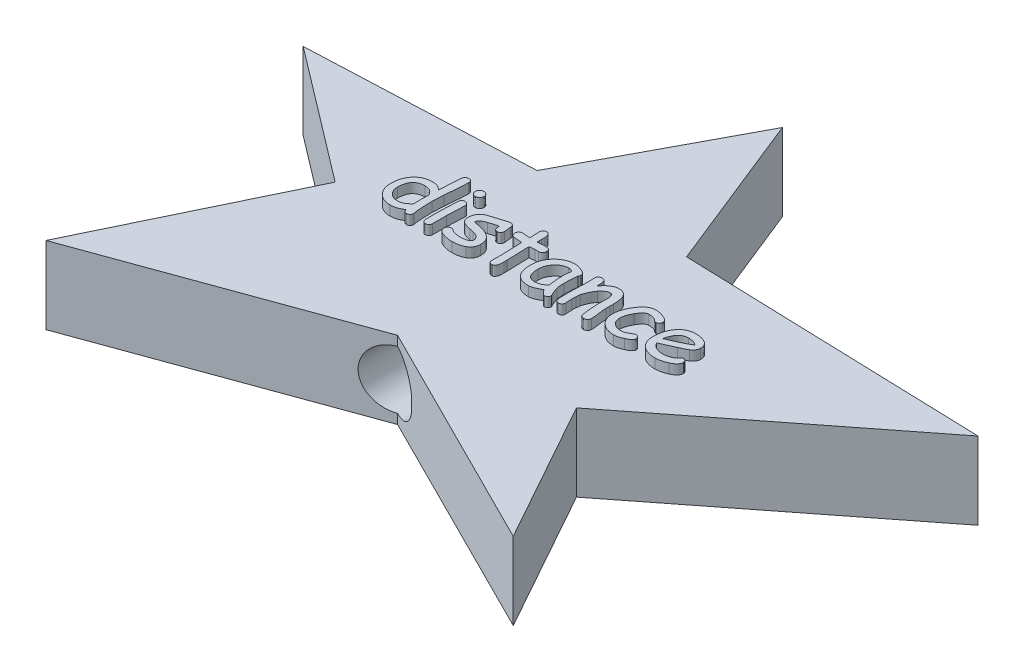
from build123d import *

# Parameters (mm, degrees)
BOSS_EXTRUDE1_DEPTH = 8
BOSS_EXTRUDE2_DEPTH = 1
SKETCH4_R           = 3
CUT_EXTRUDE2_DEPTH  = 6


with BuildPart() as part:
    # Sketch1 → Boss-Extrude1 (new body)
    with BuildSketch(Plane(origin=(0, 0, 0), x_dir=(1, 0, 0), z_dir=(0, 1, 0))):
        Polygon((0, 0), (6.633567825, -16.553321364), (37.779892833, -17.536232802), (14.474989977, -35.79394711), (22.717527292, -50.580418743), (-1.291526824, -38.544126608), (-27.987854373, -48.239108718), (-18.252203579, -28.044017747), (-32.070107167, -17.536232802), (-8.837607379, -16.553321364), align=None)
    extrude(amount=BOSS_EXTRUDE1_DEPTH)

    # Sketch2 → Boss-Extrude2 (add)
    # profile 1 of 9: a face of its own
    with BuildSketch(Plane(origin=(0, 8, 0), x_dir=(1, 0, 0), z_dir=(0, 1, 0))):
        with BuildLine():
            add(Edge.make_bspline(
                [(-10.461664561, -24.592927238), (-10.476703619, -24.785409538), (-10.506751891, -25.169992164), (-10.511070101, -25.555722418), (-10.513227061, -25.748395988)],
                knots=[0, 0, 0, 0, 1.000993213, 2, 2, 2, 2], degree=3))
            add(Edge.make_bspline(
                [(-10.513227061, -25.748395988), (-10.512713644, -25.853867404), (-10.511717154, -26.058576578), (-10.505880937, -26.355482299), (-10.496557455, -26.632464744), (-10.484200362, -26.889593577), (-10.466644874, -27.126751738), (-10.445516552, -27.343980566), (-10.422098659, -27.541199325), (-10.400455973, -27.665269594), (-10.390180186, -27.724177238)],
                knots=[0, 0, 0, 0, 1.277190667, 2.478895762, 3.595865585, 4.63308663, 5.595936305, 6.475156791, 7.276015736, 8, 8, 8, 8], degree=3))
            add(Edge.make_bspline(
                [(-10.390180186, -27.724177238), (-10.387821865, -27.740553642), (-10.383511259, -27.770486889), (-10.38326188, -27.800719285), (-10.383148936, -27.814411613)],
                knots=[0, 0, 0, 0, 1.094194912, 2, 2, 2, 2], degree=3))
            add(Edge.make_bspline(
                [(-10.383148936, -27.814411613), (-10.384347704, -27.839603647), (-10.386679004, -27.888595765), (-10.409406488, -27.958033211), (-10.44291052, -28.022083583), (-10.493353053, -28.074537965), (-10.549705295, -28.119532972), (-10.612972525, -28.150953858), (-10.680136838, -28.172950992), (-10.727106803, -28.174537895), (-10.751117686, -28.175349113)],
                knots=[0, 0, 0, 0, 1.05177295, 2.045431781, 3.033958183, 4.053154166, 5.067742846, 6.04098465, 6.998558172, 8, 8, 8, 8], degree=3))
            add(Edge.make_bspline(
                [(-10.751117686, -28.175349113), (-10.771151945, -28.174188661), (-10.810358913, -28.17191766), (-10.867223885, -28.154852627), (-10.919265193, -28.125791887), (-10.968198808, -28.086687154), (-11.011398366, -28.035288066), (-11.050169036, -27.973131262), (-11.085357075, -27.900499518), (-11.103652828, -27.847062759), (-11.113227061, -27.819099113)],
                knots=[0, 0, 0, 0, 0.880039557, 1.722234004, 2.582959466, 3.486806042, 4.461005431, 5.518665856, 6.701509044, 8, 8, 8, 8], degree=3))
            add(Edge.make_bspline(
                [(-11.113227061, -27.819099113), (-11.160856874, -27.852537597), (-11.254938286, -27.918587399), (-11.40188944, -28.00578518), (-11.552325261, -28.079303555), (-11.704551418, -28.142177348), (-11.860558081, -28.190885757), (-12.019963763, -28.224048968), (-12.182516657, -28.246486398), (-12.292058027, -28.249055557), (-12.347211436, -28.250349113)],
                knots=[0, 0, 0, 0, 1.049993693, 2.074013819, 3.079720164, 4.069387572, 5.043772359, 6.024055475, 7.005124043, 8, 8, 8, 8], degree=3))
            add(Edge.make_bspline(
                [(-12.347211436, -28.250349113), (-12.414102954, -28.248953288), (-12.54566823, -28.246207915), (-12.738565688, -28.21918088), (-12.923402596, -28.178016329), (-13.098376778, -28.117213766), (-13.26577896, -28.042527307), (-13.422604544, -27.947794462), (-13.571791488, -27.837472353), (-13.662104495, -27.752099433), (-13.707758311, -27.708942863)],
                knots=[0, 0, 0, 0, 1.066325706, 2.097297811, 3.10088944, 4.082125601, 5.046904096, 6.019277733, 6.998731951, 8, 8, 8, 8], degree=3))
            add(Edge.make_bspline(
                [(-13.707758311, -27.708942863), (-13.752256459, -27.662250343), (-13.840570359, -27.569581351), (-13.952332752, -27.414223683), (-14.05012974, -27.251200863), (-14.126731845, -27.076252453), (-14.188509069, -26.892869037), (-14.230946297, -26.699521585), (-14.259478971, -26.496903094), (-14.261959966, -26.3582642), (-14.263227061, -26.287458488)],
                knots=[0, 0, 0, 0, 0.986177228, 1.957231056, 2.922154339, 3.89105213, 4.874234197, 5.879440261, 6.916986874, 8, 8, 8, 8], degree=3))
            add(Edge.make_bspline(
                [(-14.263227061, -26.287458488), (-14.261960742, -26.20221789), (-14.259485224, -26.03558168), (-14.231147211, -25.792413139), (-14.188954231, -25.562076304), (-14.127549858, -25.344791963), (-14.049220639, -25.140742504), (-13.953794999, -24.948766585), (-13.839982641, -24.770621527), (-13.709508519, -24.606599999), (-13.566783739, -24.457879475), (-13.410492845, -24.32940096), (-13.244750475, -24.219377709), (-13.067998588, -24.130217317), (-12.881062534, -24.060026662), (-12.683488421, -24.012000276), (-12.476002383, -23.979741502), (-12.334056953, -23.976832638), (-12.261664561, -23.975349113)],
                knots=[0, 0, 0, 0, 1.189608909, 2.325557561, 3.413444142, 4.456306596, 5.473245952, 6.461102674, 7.444553072, 8.419008956, 9.383292003, 10.316965006, 11.238209328, 12.155343605, 13.075214562, 14.01970527, 14.990046571, 16, 16, 16, 16], degree=3))
            add(Edge.make_bspline(
                [(-12.261664561, -23.975349113), (-12.190084725, -23.977148028), (-12.054618513, -23.980552508), (-11.864293683, -24.005543689), (-11.698166181, -24.047691231), (-11.602468087, -24.094898326), (-11.557367686, -24.117145988)],
                knots=[0, 0, 0, 0, 1.183286269, 2.239391947, 3.170264262, 4, 4, 4, 4], degree=3))
            Line((-11.557367686, -24.117145988), (-11.188227061, -24.390192863))
            add(Edge.make_bspline(
                [(-11.188227061, -24.390192863), (-11.183222132, -24.257377604), (-11.173638513, -24.003058138), (-11.158747606, -23.638568509), (-11.142481062, -23.307688095), (-11.124835141, -23.010829769), (-11.107368116, -22.747919925), (-11.090071879, -22.518950233), (-11.0722907, -22.323864173), (-11.056895491, -22.205392092), (-11.049945811, -22.151911613)],
                knots=[0, 0, 0, 0, 1.421995194, 2.722887861, 3.902897711, 4.96628555, 5.904542012, 6.721910156, 7.423046717, 8, 8, 8, 8], degree=3))
            add(Edge.make_bspline(
                [(-11.049945811, -22.151911613), (-11.045000866, -22.12431965), (-11.035552848, -22.071601295), (-11.007618392, -21.999836619), (-10.974483233, -21.937097552), (-10.929677495, -21.886545739), (-10.876463429, -21.847491102), (-10.814516265, -21.819991513), (-10.744538021, -21.803598343), (-10.694960254, -21.801463337), (-10.669086436, -21.800349113)],
                knots=[0, 0, 0, 0, 1.166727176, 2.229197586, 3.199552252, 4.111778525, 5.021234505, 5.933023923, 6.921279318, 8, 8, 8, 8], degree=3))
            add(Edge.make_bspline(
                [(-10.669086436, -21.800349113), (-10.639322487, -21.801366631), (-10.58310893, -21.80328836), (-10.503936891, -21.820344065), (-10.437292252, -21.851478678), (-10.380646474, -21.892768527), (-10.339356625, -21.949414304), (-10.308222013, -22.016058943), (-10.291166308, -22.095230983), (-10.289244578, -22.15144454), (-10.288227061, -22.181208488)],
                knots=[0, 0, 0, 0, 1.156676403, 2.184552079, 3.122193726, 4, 4.877806274, 5.815447921, 6.843323597, 8, 8, 8, 8], degree=3))
            add(Edge.make_bspline(
                [(-10.288227061, -22.181208488), (-10.288662557, -22.205816872), (-10.289588838, -22.25815777), (-10.290095676, -22.341786931), (-10.294237126, -22.435518687), (-10.298882208, -22.539813465), (-10.304338448, -22.654709943), (-10.313447677, -22.779607445), (-10.320722802, -22.914874969), (-10.331994831, -23.060505339), (-10.343350425, -23.216390563), (-10.356488174, -23.382779129), (-10.370509303, -23.558953493), (-10.385396481, -23.746127388), (-10.403782147, -23.943256103), (-10.420404533, -24.150830115), (-10.441052795, -24.368310054), (-10.454674398, -24.516751784), (-10.461664561, -24.592927238)],
                knots=[0, 0, 0, 0, 0.488487756, 1.038990958, 1.659650684, 2.350346172, 3.111108541, 3.94243113, 4.835652975, 5.799528677, 6.841292333, 7.93775826, 9.112121531, 10.348929636, 11.66430314, 13.041467071, 14.481777404, 16, 16, 16, 16], degree=3))
        make_face()
        with BuildLine():
            add(Edge.make_bspline(
                [(-12.252289561, -24.725349113), (-12.306264115, -24.726254295), (-12.411046413, -24.728011549), (-12.562614013, -24.747838139), (-12.704535655, -24.776278627), (-12.836176012, -24.81800243), (-12.956807316, -24.874091888), (-13.067638465, -24.940331957), (-13.166948955, -25.020307815), (-13.257065305, -25.110855889), (-13.335550814, -25.214889955), (-13.403774233, -25.330531562), (-13.461434255, -25.458240868), (-13.508071123, -25.598485679), (-13.543978261, -25.750724705), (-13.569146548, -25.914927744), (-13.586447429, -26.090995957), (-13.587620803, -26.21280405), (-13.588227061, -26.275739738)],
                knots=[0, 0, 0, 0, 1.104243253, 2.143698025, 3.123882987, 4.064621318, 4.962690913, 5.841762256, 6.700969171, 7.566109394, 8.450547168, 9.361167402, 10.309521801, 11.313426945, 12.382121706, 13.507473269, 14.712163689, 16, 16, 16, 16], degree=3))
            add(Edge.make_bspline(
                [(-13.588227061, -26.275739738), (-13.586973346, -26.316795821), (-13.584491709, -26.398063313), (-13.568636501, -26.517749432), (-13.538342336, -26.632450026), (-13.49833966, -26.743039274), (-13.448472157, -26.850063195), (-13.385094929, -26.951622285), (-13.311268313, -27.049200775), (-13.226304431, -27.140416393), (-13.134380945, -27.224554338), (-13.037203975, -27.298447375), (-12.935846063, -27.361507705), (-12.830046507, -27.411266187), (-12.721403915, -27.452251793), (-12.608512736, -27.480052511), (-12.491467172, -27.496833276), (-12.412111392, -27.499165165), (-12.371820811, -27.500349113)],
                knots=[0, 0, 0, 0, 1.029546857, 2.0379122, 3.018986788, 3.998005947, 4.983762564, 5.9731616, 6.993724782, 8.047217791, 9.094088582, 10.114651764, 11.1040508, 12.080961111, 13.04158308, 14.010754683, 14.990018762, 16, 16, 16, 16], degree=3))
            add(Edge.make_bspline(
                [(-12.371820811, -27.500349113), (-12.318190439, -27.49935228), (-12.214666108, -27.497428062), (-12.06669107, -27.472851693), (-11.930460321, -27.436862704), (-11.848318202, -27.398436991), (-11.808148936, -27.379645988)],
                knots=[0, 0, 0, 0, 1.104933255, 2.132886155, 3.08694109, 4, 4, 4, 4], degree=3))
            add(Edge.make_bspline(
                [(-11.808148936, -27.379645988), (-11.781743279, -27.364387328), (-11.720323954, -27.328895818), (-11.621425475, -27.257778941), (-11.499354383, -27.167184247), (-11.413268185, -27.096113316), (-11.366352061, -27.057380363)],
                knots=[0, 0, 0, 0, 0.668068408, 1.553921218, 2.666911315, 4, 4, 4, 4], degree=3))
            add(Edge.make_bspline(
                [(-11.366352061, -27.057380363), (-11.346369908, -27.039456096), (-11.304719937, -27.002095496), (-11.268946874, -26.959063853), (-11.250336436, -26.936677238)],
                knots=[0, 0, 0, 0, 0.959527803, 2, 2, 2, 2], degree=3))
            Line((-11.250336436, -26.936677238), (-11.263227061, -26.264020988))
            Line((-11.263227061, -26.264020988), (-11.258539561, -25.814020988))
            Line((-11.258539561, -25.814020988), (-11.250336436, -25.354645988))
            add(Edge.make_bspline(
                [(-11.250336436, -25.354645988), (-11.276316059, -25.304600062), (-11.326772553, -25.207403041), (-11.423124386, -25.078963696), (-11.530331078, -24.968981619), (-11.651593684, -24.88057419), (-11.783983882, -24.810255872), (-11.929267011, -24.761428383), (-12.086451528, -24.729589089), (-12.195875254, -24.726791456), (-12.252289561, -24.725349113)],
                knots=[0, 0, 0, 0, 1.076360775, 2.090461057, 3.056777724, 4.002209313, 4.947522929, 5.911036705, 6.92301771, 8, 8, 8, 8], degree=3))
        make_face(mode=Mode.SUBTRACT)
    # profile 2 of 9: a face of its own
    with BuildSketch(Plane(origin=(0, 8, 0), x_dir=(1, 0, 0), z_dir=(0, 1, 0))):
        with BuildLine():
            add(Edge.make_bspline(
                [(-8.710883311, -23.075349113), (-8.740767948, -23.073894583), (-8.799268743, -23.071047261), (-8.883622052, -23.044706044), (-8.961962848, -23.003518761), (-9.031256924, -22.945893682), (-9.090707512, -22.877835974), (-9.130979547, -22.798972623), (-9.159439285, -22.71477864), (-9.161942642, -22.655674299), (-9.163227061, -22.625349113)],
                knots=[0, 0, 0, 0, 1.010360813, 1.97783596, 2.966809199, 3.992320244, 5.016120962, 6.005094201, 6.976456077, 8, 8, 8, 8], degree=3))
            add(Edge.make_bspline(
                [(-9.163227061, -22.625349113), (-9.161925275, -22.595033584), (-9.15938807, -22.535948064), (-9.131284133, -22.45194761), (-9.090301004, -22.373883118), (-9.031354229, -22.305856339), (-8.961615832, -22.24859436), (-8.883970841, -22.205735748), (-8.799224436, -22.179732076), (-8.740752967, -22.176831069), (-8.710883311, -22.175349113)],
                knots=[0, 0, 0, 0, 1.024235911, 1.996254496, 2.9742127, 3.99870558, 5.024909943, 6.020826883, 6.988956112, 8, 8, 8, 8], degree=3))
            add(Edge.make_bspline(
                [(-8.710883311, -22.175349113), (-8.681030958, -22.176862566), (-8.622593363, -22.179825231), (-8.538260971, -22.205178229), (-8.462340419, -22.249083134), (-8.393646895, -22.305747759), (-8.336576345, -22.374643766), (-8.293353765, -22.451331024), (-8.267534931, -22.536236676), (-8.264689725, -22.595092491), (-8.263227061, -22.625349113)],
                knots=[0, 0, 0, 0, 1.016055113, 1.988982862, 2.966544708, 3.987558975, 5.008573243, 5.997759729, 6.970687478, 8, 8, 8, 8], degree=3))
            add(Edge.make_bspline(
                [(-8.263227061, -22.625349113), (-8.264671935, -22.655615818), (-8.267482535, -22.714491247), (-8.293653055, -22.799585784), (-8.336173708, -22.877078048), (-8.393746522, -22.946000702), (-8.461984969, -23.003025911), (-8.538621032, -23.045262015), (-8.622546915, -23.070955413), (-8.681015254, -23.073863528), (-8.710883311, -23.075349113)],
                knots=[0, 0, 0, 0, 1.028642712, 2.000937341, 3.00113924, 4.021489097, 5.041838954, 6.012311441, 6.98460607, 8, 8, 8, 8], degree=3))
        make_face()
    # profile 3 of 9: a face of its own
    with BuildSketch(Plane(origin=(0, 8, 0), x_dir=(1, 0, 0), z_dir=(0, 1, 0))):
        with BuildLine():
            add(Edge.make_bspline(
                [(-8.488227061, -26.293317863), (-8.488227061, -26.337458488), (-8.488227061, -26.435895988), (-8.488227061, -26.598005363), (-8.488227061, -26.789802238), (-8.488227061, -27.000739738), (-8.488227061, -27.211677238), (-8.488227061, -27.402692863), (-8.488227061, -27.564411613), (-8.488227061, -27.662458488), (-8.488227061, -27.706599113)],
                knots=[0, 0, 0, 0, 0.749585406, 1.671641791, 2.752902156, 4.006633499, 5.253731343, 6.334991708, 7.250414594, 8, 8, 8, 8], degree=3))
            add(Edge.make_bspline(
                [(-8.488227061, -27.706599113), (-8.488951028, -27.734511606), (-8.490338723, -27.788014014), (-8.512278439, -27.863721729), (-8.542664834, -27.933142), (-8.589693679, -27.991208149), (-8.644509472, -28.040880472), (-8.710612136, -28.074388296), (-8.784029106, -28.096998909), (-8.836088473, -28.099201106), (-8.863227061, -28.100349113)],
                knots=[0, 0, 0, 0, 1.092439727, 2.093978393, 3.075920231, 4.049187075, 5.006468634, 5.960792571, 6.936959645, 8, 8, 8, 8], degree=3))
            add(Edge.make_bspline(
                [(-8.863227061, -28.100349113), (-8.889583276, -28.099176223), (-8.94048309, -28.096911106), (-9.0126947, -28.074191038), (-9.078481873, -28.04053033), (-9.134500196, -27.9916808), (-9.181130564, -27.932786521), (-9.213388604, -27.864068213), (-9.234566707, -27.787912765), (-9.236971708, -27.734486394), (-9.238227061, -27.706599113)],
                knots=[0, 0, 0, 0, 1.035816974, 2.000396925, 2.957821689, 3.929870099, 4.906299321, 5.898028532, 6.902821438, 8, 8, 8, 8], degree=3))
            add(Edge.make_bspline(
                [(-9.238227061, -27.706599113), (-9.238227061, -27.662458488), (-9.238227061, -27.564411613), (-9.238227061, -27.402692863), (-9.238227061, -27.211677238), (-9.238227061, -27.000739738), (-9.238227061, -26.789802238), (-9.238227061, -26.598005363), (-9.238227061, -26.435895988), (-9.238227061, -26.337458488), (-9.238227061, -26.293317863)],
                knots=[0, 0, 0, 0, 0.749585406, 1.665008292, 2.746268657, 3.993366501, 5.247097844, 6.328358209, 7.250414594, 8, 8, 8, 8], degree=3))
            add(Edge.make_bspline(
                [(-9.238227061, -26.293317863), (-9.2377231, -26.228078159), (-9.236654573, -26.089753259), (-9.229032424, -25.870587816), (-9.217429277, -25.62837033), (-9.200727093, -25.371052239), (-9.18402472, -25.113734146), (-9.172422077, -24.871516663), (-9.164784763, -24.651960812), (-9.163727352, -24.51324513), (-9.163227061, -24.447614738)],
                knots=[0, 0, 0, 0, 0.847472393, 1.796858752, 2.848468188, 3.99746302, 5.146457853, 6.198067289, 7.147453648, 8, 8, 8, 8], degree=3))
            add(Edge.make_bspline(
                [(-9.163227061, -24.447614738), (-9.161885936, -24.419370338), (-9.159297673, -24.364860908), (-9.139225039, -24.287467017), (-9.10535011, -24.218809424), (-9.060035547, -24.158930535), (-9.003059597, -24.110543392), (-8.938273567, -24.074718702), (-8.86520725, -24.054263182), (-8.814526517, -24.051686313), (-8.788227061, -24.050349113)],
                knots=[0, 0, 0, 0, 1.106105024, 2.134694061, 3.106937955, 4.089851019, 5.056291864, 6.015429525, 6.970158461, 8, 8, 8, 8], degree=3))
            add(Edge.make_bspline(
                [(-8.788227061, -24.050349113), (-8.761950991, -24.05175242), (-8.710939272, -24.054476764), (-8.63753306, -24.074153109), (-8.57325717, -24.110966073), (-8.516273338, -24.158826063), (-8.471457113, -24.219165689), (-8.435416575, -24.28693487), (-8.417652727, -24.365109703), (-8.414739326, -24.419422486), (-8.413227061, -24.447614738)],
                knots=[0, 0, 0, 0, 1.029274577, 1.998208454, 2.943413731, 3.909322518, 4.891694456, 5.870245778, 6.894503923, 8, 8, 8, 8], degree=3))
            add(Edge.make_bspline(
                [(-8.413227061, -24.447614738), (-8.413727352, -24.51324513), (-8.414784763, -24.651960812), (-8.422422077, -24.871516663), (-8.43402472, -25.113734146), (-8.450727093, -25.371052239), (-8.467429277, -25.62837033), (-8.479032424, -25.870587816), (-8.486654573, -26.089753259), (-8.4877231, -26.228078159), (-8.488227061, -26.293317863)],
                knots=[0, 0, 0, 0, 0.852546352, 1.801932711, 2.853542147, 4.00253698, 5.151531812, 6.203141248, 7.152527607, 8, 8, 8, 8], degree=3))
        make_face()
    # profile 4 of 9: a face of its own
    with BuildSketch(Plane(origin=(0, 8, 0), x_dir=(1, 0, 0), z_dir=(0, 1, 0))):
        with BuildLine():
            add(Edge.make_bspline(
                [(-4.428852061, -25.100349113), (-4.460773313, -25.098923186), (-4.5211081, -25.096228021), (-4.60370009, -25.06610973), (-4.671230646, -25.015997003), (-4.700837468, -24.970218427), (-4.715961436, -24.946833488)],
                knots=[0, 0, 0, 0, 1.113280398, 2.104226211, 3.031587307, 4, 4, 4, 4], degree=3))
            add(Edge.make_bspline(
                [(-4.715961436, -24.946833488), (-4.725485021, -24.924362241), (-4.748114914, -24.870966178), (-4.771520189, -24.772931991), (-4.795105557, -24.646667054), (-4.806780537, -24.552400099), (-4.813227061, -24.500349113)],
                knots=[0, 0, 0, 0, 0.637769588, 1.515464783, 2.628124727, 4, 4, 4, 4], degree=3))
            add(Edge.make_bspline(
                [(-4.813227061, -24.500349113), (-4.841004231, -24.506820123), (-4.899882635, -24.520536521), (-4.992912341, -24.546071358), (-5.096567716, -24.573669196), (-5.211065902, -24.605568329), (-5.33560327, -24.641770247), (-5.471005098, -24.682104022), (-5.617054022, -24.724709107), (-5.717573563, -24.756044178), (-5.769477061, -24.772224113)],
                knots=[0, 0, 0, 0, 0.688358012, 1.459091098, 2.328218768, 3.277569983, 4.327926315, 5.458620895, 6.687753033, 8, 8, 8, 8], degree=3))
            add(Edge.make_bspline(
                [(-5.769477061, -24.772224113), (-5.82369, -24.792970516), (-5.926054572, -24.83214376), (-6.067120628, -24.899152188), (-6.187106402, -24.96970116), (-6.285719853, -25.045001179), (-6.364065449, -25.123333186), (-6.41894238, -25.207240342), (-6.456209328, -25.294261761), (-6.460906928, -25.355077833), (-6.463227061, -25.385114738)],
                knots=[0, 0, 0, 0, 1.420783027, 2.682714635, 3.819374856, 4.821764251, 5.71454581, 6.515635649, 7.266876187, 8, 8, 8, 8], degree=3))
            add(Edge.make_bspline(
                [(-6.463227061, -25.385114738), (-6.422445329, -25.398518943), (-6.342533164, -25.424784602), (-6.259926772, -25.440634701), (-6.219477061, -25.448395988)],
                knots=[0, 0, 0, 0, 1.020663906, 2, 2, 2, 2], degree=3))
            add(Edge.make_bspline(
                [(-6.219477061, -25.448395988), (-6.142840838, -25.46205616), (-5.994248242, -25.488542334), (-5.779799621, -25.533567778), (-5.5812856, -25.584902842), (-5.397036445, -25.636579878), (-5.227855599, -25.693672942), (-5.07469451, -25.756355592), (-4.934944665, -25.819365571), (-4.850359281, -25.868786965), (-4.809711436, -25.892536613)],
                knots=[0, 0, 0, 0, 1.257132486, 2.437497217, 3.537587629, 4.567888916, 5.527452356, 6.418927424, 7.240209243, 8, 8, 8, 8], degree=3))
            add(Edge.make_bspline(
                [(-4.809711436, -25.892536613), (-4.756483012, -25.927652607), (-4.652386287, -25.996327569), (-4.514388119, -26.117633965), (-4.398348075, -26.251679232), (-4.30231939, -26.396175531), (-4.228956296, -26.553600651), (-4.176433429, -26.721828048), (-4.143851722, -26.901832944), (-4.140132762, -27.025599492), (-4.138227061, -27.089020988)],
                knots=[0, 0, 0, 0, 1.062419888, 2.077732601, 3.051996638, 4.01127431, 4.961174307, 5.937634961, 6.943185532, 8, 8, 8, 8], degree=3))
            add(Edge.make_bspline(
                [(-4.138227061, -27.089020988), (-4.140134954, -27.141074354), (-4.143846156, -27.242327655), (-4.169627661, -27.38959487), (-4.214656203, -27.526697304), (-4.276913435, -27.654419044), (-4.357937781, -27.771679004), (-4.455997993, -27.878942819), (-4.572053857, -27.9761041), (-4.659372185, -28.03030781), (-4.704242686, -28.058161613)],
                knots=[0, 0, 0, 0, 1.057807568, 2.057628868, 3.026718455, 3.981821159, 4.935338738, 5.913169247, 6.927634763, 8, 8, 8, 8], degree=3))
            add(Edge.make_bspline(
                [(-4.704242686, -28.058161613), (-4.744601879, -28.079401215), (-4.826320914, -28.122407025), (-4.955657265, -28.177812435), (-5.093121566, -28.222927553), (-5.237914531, -28.260672651), (-5.390619523, -28.289667451), (-5.550995941, -28.310928335), (-5.719317336, -28.32215261), (-5.833915565, -28.324267504), (-5.892523936, -28.325349113)],
                knots=[0, 0, 0, 0, 0.88872299, 1.799480584, 2.738474474, 3.706138857, 4.714061432, 5.766108683, 6.857532698, 8, 8, 8, 8], degree=3))
            add(Edge.make_bspline(
                [(-5.892523936, -28.325349113), (-5.978987362, -28.323606869), (-6.151033109, -28.320140135), (-6.405103214, -28.283572176), (-6.654997389, -28.231905269), (-6.815270071, -28.177068984), (-6.895648936, -28.149567863)],
                knots=[0, 0, 0, 0, 1.0130502, 2.0157769, 3.004885932, 4, 4, 4, 4], degree=3))
            add(Edge.make_bspline(
                [(-6.895648936, -28.149567863), (-6.944500568, -28.130986514), (-7.037310226, -28.095685161), (-7.163056145, -28.030784628), (-7.270814307, -27.961996309), (-7.358043417, -27.885363503), (-7.427837653, -27.80435142), (-7.477294908, -27.716481299), (-7.508186791, -27.622706221), (-7.511543449, -27.557609371), (-7.513227061, -27.524958488)],
                knots=[0, 0, 0, 0, 1.336630132, 2.539366265, 3.615209776, 4.599865311, 5.500995956, 6.338014507, 7.166391395, 8, 8, 8, 8], degree=3))
            add(Edge.make_bspline(
                [(-7.513227061, -27.524958488), (-7.511587469, -27.499005507), (-7.508338529, -27.447578243), (-7.484045669, -27.373241817), (-7.442704972, -27.304883417), (-7.38661261, -27.244214583), (-7.321609367, -27.192139201), (-7.249680699, -27.153966952), (-7.173506622, -27.128621379), (-7.120457793, -27.126446362), (-7.093695811, -27.125349113)],
                knots=[0, 0, 0, 0, 0.973650993, 1.929343195, 2.902994188, 3.951976707, 5.017346595, 6.014907148, 6.998563738, 8, 8, 8, 8], degree=3))
            add(Edge.make_bspline(
                [(-7.093695811, -27.125349113), (-7.070720833, -27.12809576), (-7.0199616, -27.134164), (-6.942409749, -27.172944559), (-6.855697245, -27.230438129), (-6.798888288, -27.281495614), (-6.767914561, -27.309333488)],
                knots=[0, 0, 0, 0, 0.723957644, 1.599458972, 2.691162313, 4, 4, 4, 4], degree=3))
            add(Edge.make_bspline(
                [(-6.767914561, -27.309333488), (-6.746934287, -27.324328404), (-6.698453677, -27.358978221), (-6.600522306, -27.393113825), (-6.475675482, -27.428761624), (-6.380664768, -27.445467176), (-6.328461436, -27.454645988)],
                knots=[0, 0, 0, 0, 0.659750349, 1.524532022, 2.639862039, 4, 4, 4, 4], degree=3))
            add(Edge.make_bspline(
                [(-6.328461436, -27.454645988), (-6.284758849, -27.461644489), (-6.201435018, -27.474987907), (-6.080973585, -27.48855204), (-5.971623974, -27.499329097), (-5.901921829, -27.500022476), (-5.869086436, -27.500349113)],
                knots=[0, 0, 0, 0, 1.149059048, 2.190808571, 3.14772333, 4, 4, 4, 4], degree=3))
            add(Edge.make_bspline(
                [(-5.869086436, -27.500349113), (-5.813565806, -27.499676877), (-5.705816358, -27.498372261), (-5.549830248, -27.481831244), (-5.403578227, -27.460372011), (-5.311474189, -27.435220511), (-5.266742686, -27.423005363)],
                knots=[0, 0, 0, 0, 1.092966145, 2.121130488, 3.087503021, 4, 4, 4, 4], degree=3))
            add(Edge.make_bspline(
                [(-5.266742686, -27.423005363), (-5.236848398, -27.413409956), (-5.180464617, -27.395312006), (-5.103043532, -27.360895858), (-5.037246127, -27.322992943), (-4.983180952, -27.279928864), (-4.93970664, -27.233280237), (-4.910185224, -27.180487434), (-4.89144895, -27.12425467), (-4.889307574, -27.085259821), (-4.888227061, -27.065583488)],
                knots=[0, 0, 0, 0, 1.343963468, 2.534856837, 3.622417877, 4.586634739, 5.487043191, 6.333773438, 7.159242063, 8, 8, 8, 8], degree=3))
            add(Edge.make_bspline(
                [(-4.888227061, -27.065583488), (-4.890118106, -27.023067634), (-4.893823155, -26.939768011), (-4.933899101, -26.821355131), (-4.995430054, -26.713260642), (-5.084445476, -26.618357317), (-5.195882872, -26.533255601), (-5.333052053, -26.462026378), (-5.492347012, -26.397401835), (-5.609245705, -26.367642634), (-5.671039561, -26.351911613)],
                knots=[0, 0, 0, 0, 0.8833748, 1.730761124, 2.577325104, 3.459384827, 4.423749971, 5.48782325, 6.672037441, 8, 8, 8, 8], degree=3))
            Line((-5.671039561, -26.351911613), (-6.099945811, -26.261677238))
            add(Edge.make_bspline(
                [(-6.099945811, -26.261677238), (-6.144112058, -26.252032151), (-6.229097773, -26.233472852), (-6.351728713, -26.204664044), (-6.463816084, -26.173001198), (-6.566238982, -26.140198068), (-6.658976994, -26.106350955), (-6.742031487, -26.071489247), (-6.815277194, -26.035750335), (-6.858738541, -26.008512057), (-6.879242686, -25.995661613)],
                knots=[0, 0, 0, 0, 1.310902894, 2.522469704, 3.652051718, 4.687281161, 5.640501579, 6.513563709, 7.298730768, 8, 8, 8, 8], degree=3))
            add(Edge.make_bspline(
                [(-6.879242686, -25.995661613), (-6.906026106, -25.977280816), (-6.958823885, -25.941047011), (-7.026329857, -25.874393401), (-7.08532588, -25.802347812), (-7.131761905, -25.72211777), (-7.168825812, -25.635625887), (-7.194050076, -25.541701399), (-7.21133134, -25.441220704), (-7.212585872, -25.371519922), (-7.213227061, -25.335895988)],
                knots=[0, 0, 0, 0, 1.005676932, 1.982476718, 2.930448784, 3.886285413, 4.847176578, 5.84073869, 6.896405766, 8, 8, 8, 8], degree=3))
            add(Edge.make_bspline(
                [(-7.213227061, -25.335895988), (-7.211081178, -25.27011804), (-7.206909763, -25.142251288), (-7.171585231, -24.957584302), (-7.11118342, -24.788422104), (-7.028498579, -24.633083638), (-6.919983903, -24.494117092), (-6.789636635, -24.368281929), (-6.634565504, -24.258328949), (-6.518409364, -24.200736724), (-6.458539561, -24.171052238)],
                knots=[0, 0, 0, 0, 1.068606491, 2.07728037, 3.04127803, 3.978772602, 4.924935478, 5.89489525, 6.914975919, 8, 8, 8, 8], degree=3))
            add(Edge.make_bspline(
                [(-6.458539561, -24.171052238), (-6.435947071, -24.161900799), (-6.387584747, -24.142310888), (-6.30955052, -24.114904314), (-6.22196603, -24.08546915), (-6.125762469, -24.053667225), (-6.019115453, -24.022515637), (-5.903886293, -23.987907687), (-5.778038988, -23.95475317), (-5.646443357, -23.919054881), (-5.51477052, -23.883615861), (-5.389601159, -23.84987922), (-5.274396821, -23.817790678), (-5.170475907, -23.783634367), (-5.074822971, -23.755463304), (-4.989763995, -23.726108098), (-4.914570556, -23.697792191), (-4.867892214, -23.67931281), (-4.846039561, -23.670661613)],
                knots=[0, 0, 0, 0, 0.692458193, 1.482301752, 2.349167551, 3.317828608, 4.360643236, 5.505531183, 6.735877285, 8.057724724, 9.379572162, 10.609918264, 11.741060781, 12.776526544, 13.717321461, 14.573680274, 15.332262693, 16, 16, 16, 16], degree=3))
            add(Edge.make_bspline(
                [(-4.846039561, -23.670661613), (-4.820078336, -23.659906728), (-4.767566942, -23.638152976), (-4.684489176, -23.616430544), (-4.598027039, -23.603211216), (-4.539447055, -23.601312776), (-4.509711436, -23.600349113)],
                knots=[0, 0, 0, 0, 0.973505182, 1.969094881, 2.969098002, 4, 4, 4, 4], degree=3))
            add(Edge.make_bspline(
                [(-4.509711436, -23.600349113), (-4.483814379, -23.601695925), (-4.433064342, -23.60433525), (-4.360286003, -23.625138375), (-4.296823579, -23.663734764), (-4.240153316, -23.71243177), (-4.194652573, -23.773811661), (-4.160998864, -23.844102456), (-4.142411764, -23.923634738), (-4.139662773, -23.979161654), (-4.138227061, -24.008161613)],
                knots=[0, 0, 0, 0, 1.005046543, 1.96957328, 2.900736222, 3.868001237, 4.853754822, 5.844163703, 6.87407461, 8, 8, 8, 8], degree=3))
            add(Edge.make_bspline(
                [(-4.138227061, -24.008161613), (-4.137681635, -24.02965935), (-4.136469563, -24.07743267), (-4.128699819, -24.155983573), (-4.116996123, -24.248596102), (-4.100705916, -24.350346588), (-4.084597673, -24.451728831), (-4.072578857, -24.544304958), (-4.065036863, -24.622880441), (-4.063785582, -24.671040099), (-4.063227061, -24.692536613)],
                knots=[0, 0, 0, 0, 0.748774702, 1.663963758, 2.747342733, 3.999972183, 5.252601633, 6.322484583, 7.251225298, 8, 8, 8, 8], degree=3))
            add(Edge.make_bspline(
                [(-4.063227061, -24.692536613), (-4.063970889, -24.721605809), (-4.065398227, -24.77738692), (-4.087019691, -24.856323217), (-4.117691549, -24.928231341), (-4.164174918, -24.988876326), (-4.21899396, -25.038354811), (-4.282112028, -25.075272139), (-4.353300594, -25.096453123), (-4.403324819, -25.099032741), (-4.428852061, -25.100349113)],
                knots=[0, 0, 0, 0, 1.132128027, 2.172449538, 3.176761216, 4.16893575, 5.131066294, 6.047428377, 7.003607416, 8, 8, 8, 8], degree=3))
        make_face()
    # profile 5 of 9: a face of its own
    with BuildSketch(Plane(origin=(0, 8, 0), x_dir=(1, 0, 0), z_dir=(0, 1, 0))):
        with BuildLine():
            add(Edge.make_bspline(
                [(-0.485492686, -24.754645988), (-0.51635993, -24.754064348), (-0.583605385, -24.752797221), (-0.686667024, -24.746488908), (-0.789721786, -24.74005521), (-0.856578139, -24.738813184), (-0.887445811, -24.738239738)],
                knots=[0, 0, 0, 0, 0.920717115, 2.005816965, 3.079282885, 4, 4, 4, 4], degree=3))
            add(Edge.make_bspline(
                [(-0.887445811, -24.738239738), (-0.897212455, -24.738603202), (-0.920274065, -24.739461436), (-0.960552255, -24.741755561), (-1.012109285, -24.746710115), (-1.075399496, -24.753724582), (-1.149919763, -24.763450828), (-1.235956461, -24.773603735), (-1.333109729, -24.78697957), (-1.401890425, -24.795727571), (-1.438227061, -24.800349113)],
                knots=[0, 0, 0, 0, 0.423045876, 0.998922293, 1.745956013, 2.664623774, 3.755177246, 4.998829415, 6.414490547, 8, 8, 8, 8], degree=3))
            Line((-1.438227061, -24.800349113), (-1.366742686, -27.101911613))
            Line((-1.366742686, -27.101911613), (-1.363227061, -27.274177238))
            Line((-1.363227061, -27.274177238), (-1.358539561, -27.472224113))
            add(Edge.make_bspline(
                [(-1.358539561, -27.472224113), (-1.358150091, -27.539059124), (-1.357424321, -27.663604823), (-1.373525503, -27.837873796), (-1.402395692, -27.985843071), (-1.445419732, -28.107912158), (-1.500469471, -28.205659366), (-1.57430329, -28.274540691), (-1.661903744, -28.31929138), (-1.726367025, -28.323299932), (-1.759320811, -28.325349113)],
                knots=[0, 0, 0, 0, 1.528621386, 2.848555227, 3.998559243, 4.968438543, 5.802376151, 6.536002899, 7.251601123, 8, 8, 8, 8], degree=3))
            add(Edge.make_bspline(
                [(-1.759320811, -28.325349113), (-1.78409796, -28.324500861), (-1.832947432, -28.322828487), (-1.902396574, -28.30127033), (-1.968073978, -28.270552338), (-2.026392852, -28.22650691), (-2.07625013, -28.173015358), (-2.11187741, -28.11083865), (-2.134086568, -28.04244994), (-2.136569427, -27.994658875), (-2.137836436, -27.970270988)],
                knots=[0, 0, 0, 0, 1.02652806, 2.023854815, 2.99735258, 4.030413798, 5.0421858, 6.01730832, 6.988227997, 8, 8, 8, 8], degree=3))
            add(Edge.make_bspline(
                [(-2.137836436, -27.970270988), (-2.13749265, -27.942535838), (-2.136722694, -27.880419259), (-2.134301597, -27.7784637), (-2.130594455, -27.657765889), (-2.126562179, -27.52492696), (-2.119967479, -27.391793899), (-2.116903073, -27.271057818), (-2.114307942, -27.16910814), (-2.11356216, -27.107381424), (-2.113227061, -27.079645988)],
                knots=[0, 0, 0, 0, 0.747128177, 1.673293467, 2.746990194, 3.999802079, 5.253011562, 6.337225674, 7.252871823, 8, 8, 8, 8], degree=3))
            Line((-2.113227061, -27.079645988), (-2.188227061, -24.800349113))
            add(Edge.make_bspline(
                [(-2.188227061, -24.800349113), (-2.213234627, -24.799309613), (-2.266412529, -24.797099144), (-2.350351767, -24.790763258), (-2.443709581, -24.78373945), (-2.546060592, -24.775603309), (-2.6577748, -24.766164268), (-2.778469645, -24.755525854), (-2.908620129, -24.744160449), (-2.998395759, -24.734854035), (-3.044867686, -24.730036613)],
                knots=[0, 0, 0, 0, 0.69876017, 1.485894292, 2.349961702, 3.312734694, 4.352486331, 5.480100212, 6.695585878, 8, 8, 8, 8], degree=3))
            add(Edge.make_bspline(
                [(-3.044867686, -24.730036613), (-3.072020219, -24.724968336), (-3.123386153, -24.715380399), (-3.194604592, -24.689220464), (-3.255635329, -24.653185315), (-3.304223709, -24.60493177), (-3.342752821, -24.548591567), (-3.370215812, -24.482515402), (-3.384594174, -24.406429474), (-3.386976438, -24.352748759), (-3.388227061, -24.324567863)],
                knots=[0, 0, 0, 0, 1.119713667, 2.118223711, 3.064630397, 3.972940108, 4.874581196, 5.819924503, 6.855520493, 8, 8, 8, 8], degree=3))
            add(Edge.make_bspline(
                [(-3.388227061, -24.324567863), (-3.386902253, -24.295536906), (-3.384343996, -24.239476957), (-3.363941261, -24.159565785), (-3.330778744, -24.08787357), (-3.284749224, -24.025051426), (-3.227677467, -23.974219482), (-3.162973577, -23.934944472), (-3.089720496, -23.912063721), (-3.038384291, -23.909742656), (-3.012055186, -23.908552238)],
                knots=[0, 0, 0, 0, 1.10983231, 2.143130888, 3.132909426, 4.116573268, 5.101031898, 6.039351675, 6.994430595, 8, 8, 8, 8], degree=3))
            Line((-3.012055186, -23.908552238), (-2.188227061, -23.975349113))
            add(Edge.make_bspline(
                [(-2.188227061, -23.975349113), (-2.188464963, -23.938627351), (-2.188978818, -23.859310254), (-2.193250243, -23.731597164), (-2.197082972, -23.586607863), (-2.205686817, -23.431592822), (-2.214415896, -23.279713349), (-2.218197824, -23.144486999), (-2.222526064, -23.032795893), (-2.22312093, -22.966367709), (-2.223383311, -22.937067863)],
                knots=[0, 0, 0, 0, 0.848238914, 1.8321519, 2.951624046, 4.198441437, 5.418224434, 6.465550233, 7.323191773, 8, 8, 8, 8], degree=3))
            add(Edge.make_bspline(
                [(-2.223383311, -22.937067863), (-2.22209652, -22.910358542), (-2.219574649, -22.858013216), (-2.198041572, -22.783818228), (-2.162965399, -22.716486891), (-2.113734404, -22.659104603), (-2.055219164, -22.610703894), (-1.989321536, -22.574942035), (-1.916385368, -22.554338306), (-1.866091537, -22.551705522), (-1.840180186, -22.550349113)],
                knots=[0, 0, 0, 0, 1.054098555, 2.065838051, 3.025944053, 4.034260515, 5.032715164, 6.013703489, 6.976661236, 8, 8, 8, 8], degree=3))
            add(Edge.make_bspline(
                [(-1.840180186, -22.550349113), (-1.81262394, -22.552126272), (-1.7592038, -22.555571445), (-1.683074776, -22.58338435), (-1.619125726, -22.632839956), (-1.562127966, -22.697851089), (-1.517474022, -22.782868141), (-1.481684915, -22.885246463), (-1.453498295, -23.005452109), (-1.443529646, -23.092387276), (-1.438227061, -23.138630363)],
                knots=[0, 0, 0, 0, 0.839179043, 1.626820346, 2.427236251, 3.279915469, 4.244758927, 5.33359862, 6.581671405, 8, 8, 8, 8], degree=3))
            add(Edge.make_bspline(
                [(-1.438227061, -23.138630363), (-1.434537846, -23.192907593), (-1.426476263, -23.311512905), (-1.426497041, -23.430399643), (-1.426508311, -23.494880363)],
                knots=[0, 0, 0, 0, 0.915257976, 2, 2, 2, 2], degree=3))
            Line((-1.426508311, -23.494880363), (-1.434711436, -23.726911613))
            Line((-1.434711436, -23.726911613), (-1.438227061, -23.975349113))
            add(Edge.make_bspline(
                [(-1.438227061, -23.975349113), (-1.399166847, -23.970256681), (-1.3257552, -23.960685719), (-1.222280981, -23.94741346), (-1.131913102, -23.93764528), (-1.054801431, -23.926872977), (-0.990060086, -23.922641889), (-0.939136438, -23.915338541), (-0.901125719, -23.913433767), (-0.880413942, -23.912455348), (-0.872211436, -23.912067863)],
                knots=[0, 0, 0, 0, 1.659498559, 3.118941497, 4.394719153, 5.488798678, 6.397639186, 7.126385805, 7.654021676, 8, 8, 8, 8], degree=3))
            add(Edge.make_bspline(
                [(-0.872211436, -23.912067863), (-0.839401233, -23.912530803), (-0.776514606, -23.913418111), (-0.686617013, -23.913547181), (-0.605419799, -23.918073177), (-0.533047316, -23.920585314), (-0.469715284, -23.926479627), (-0.415568689, -23.934135552), (-0.369759113, -23.939726926), (-0.342855946, -23.947332822), (-0.330805186, -23.950739738)],
                knots=[0, 0, 0, 0, 1.447613272, 2.774609975, 3.964759937, 5.034410691, 5.968933724, 6.76833278, 7.448298163, 8, 8, 8, 8], degree=3))
            add(Edge.make_bspline(
                [(-0.330805186, -23.950739738), (-0.311295633, -23.957788278), (-0.273380399, -23.971486543), (-0.224090955, -24.004148031), (-0.181324626, -24.042282397), (-0.147842699, -24.088695932), (-0.11997228, -24.140858818), (-0.101743071, -24.200940421), (-0.089738107, -24.267442138), (-0.088742371, -24.31435314), (-0.088227061, -24.338630363)],
                knots=[0, 0, 0, 0, 1.005767345, 1.954627295, 2.855857429, 3.779451047, 4.722967414, 5.720622874, 6.820384471, 8, 8, 8, 8], degree=3))
            add(Edge.make_bspline(
                [(-0.088227061, -24.338630363), (-0.089412746, -24.367703772), (-0.091706388, -24.423944657), (-0.114193511, -24.50387604), (-0.14739986, -24.577198404), (-0.197978814, -24.638875502), (-0.256800689, -24.690904359), (-0.326097456, -24.728229512), (-0.403183765, -24.751185301), (-0.457595285, -24.753473039), (-0.485492686, -24.754645988)],
                knots=[0, 0, 0, 0, 1.079895878, 2.088998209, 3.071435682, 4.05505688, 5.03479875, 5.978573441, 6.963591752, 8, 8, 8, 8], degree=3))
        make_face()
    # profile 6 of 9: a face of its own
    with BuildSketch(Plane(origin=(0, 8, 0), x_dir=(1, 0, 0), z_dir=(0, 1, 0))):
        with BuildLine():
            add(Edge.make_bspline(
                [(3.741460439, -28.400349113), (3.725904656, -28.396830489), (3.68743744, -28.388129437), (3.627352502, -28.345740825), (3.551054383, -28.284737301), (3.497256974, -28.23257636), (3.467241689, -28.203474113)],
                knots=[0, 0, 0, 0, 0.555695463, 1.374155035, 2.534957635, 4, 4, 4, 4], degree=3))
            add(Edge.make_bspline(
                [(3.467241689, -28.203474113), (3.439162108, -28.174093213), (3.385224646, -28.117656076), (3.313832857, -28.032425432), (3.250846308, -27.954014166), (3.217191833, -27.900660316), (3.201226064, -27.875349113)],
                knots=[0, 0, 0, 0, 1.151952229, 2.212760143, 3.152128841, 4, 4, 4, 4], degree=3))
            add(Edge.make_bspline(
                [(3.201226064, -27.875349113), (3.139691244, -27.91044309), (3.021387854, -27.977912799), (2.847931006, -28.069912726), (2.685277511, -28.14734332), (2.534407612, -28.210938683), (2.395152726, -28.260803824), (2.268253895, -28.297759843), (2.15242997, -28.320524965), (2.079044495, -28.323807676), (2.044585439, -28.325349113)],
                knots=[0, 0, 0, 0, 1.357382431, 2.60962722, 3.761399541, 4.808177135, 5.745711274, 6.593953003, 7.339773276, 8, 8, 8, 8], degree=3))
            add(Edge.make_bspline(
                [(2.044585439, -28.325349113), (1.969509917, -28.323902515), (1.824396957, -28.321106396), (1.61460515, -28.29605086), (1.420468614, -28.255950414), (1.242355427, -28.197984222), (1.07856146, -28.125908802), (0.931956892, -28.034737672), (0.798704817, -27.929468403), (0.725389537, -27.844955859), (0.688726064, -27.802692863)],
                knots=[0, 0, 0, 0, 1.198237041, 2.31606415, 3.368011987, 4.358092637, 5.301625415, 6.21724908, 7.108482723, 8, 8, 8, 8], degree=3))
            add(Edge.make_bspline(
                [(0.688726064, -27.802692863), (0.656465255, -27.759619591), (0.590624423, -27.671711686), (0.508636087, -27.523229712), (0.439683798, -27.358475887), (0.384275264, -27.177262206), (0.339326805, -26.98035163), (0.308664554, -26.767162388), (0.28952369, -26.537421562), (0.287711305, -26.37890546), (0.286772939, -26.296833488)],
                knots=[0, 0, 0, 0, 0.812552431, 1.658331892, 2.555229492, 3.507519434, 4.518618694, 5.604829532, 6.759896565, 8, 8, 8, 8], degree=3))
            add(Edge.make_bspline(
                [(0.286772939, -26.296833488), (0.288828605, -26.218219217), (0.292873957, -26.063513961), (0.324021683, -25.835827518), (0.375473846, -25.616728092), (0.448433997, -25.406371304), (0.54179698, -25.204812056), (0.654448851, -25.011582983), (0.789378938, -24.827983424), (0.942639617, -24.655268435), (1.110242257, -24.497019553), (1.286907701, -24.356848831), (1.472522323, -24.23841119), (1.666105842, -24.141880999), (1.868399388, -24.067984196), (2.077392912, -24.013587382), (2.295135062, -23.981206791), (2.442914143, -23.977323035), (2.518022939, -23.975349113)],
                knots=[0, 0, 0, 0, 1.054731984, 2.075610185, 3.077564362, 4.070606348, 5.058056501, 6.05423441, 7.067099876, 8.110607853, 9.148928189, 10.156761868, 11.132552149, 12.098435385, 13.053748134, 14.01750944, 14.992398115, 16, 16, 16, 16], degree=3))
            add(Edge.make_bspline(
                [(2.518022939, -23.975349113), (2.577132685, -23.977976912), (2.700072918, -23.983442375), (2.889100259, -24.017810392), (3.088240168, -24.074591867), (3.221181975, -24.127265087), (3.290288564, -24.154645988)],
                knots=[0, 0, 0, 0, 0.889365109, 1.849758484, 2.882248842, 4, 4, 4, 4], degree=3))
            add(Edge.make_bspline(
                [(3.290288564, -24.154645988), (3.332784014, -24.173134013), (3.413285172, -24.208156759), (3.523347493, -24.268115229), (3.616346562, -24.33093173), (3.6929662, -24.396879719), (3.752570151, -24.466377501), (3.795645423, -24.538744878), (3.823815905, -24.614348247), (3.826727391, -24.666520944), (3.828179189, -24.692536613)],
                knots=[0, 0, 0, 0, 1.381705711, 2.617431031, 3.732296057, 4.723070722, 5.624086893, 6.449303074, 7.226752293, 8, 8, 8, 8], degree=3))
            add(Edge.make_bspline(
                [(3.828179189, -24.692536613), (3.827445081, -24.710255171), (3.825996553, -24.745217124), (3.809234296, -24.795426037), (3.785049299, -24.843503891), (3.760890708, -24.870743706), (3.748491689, -24.884724113)],
                knots=[0, 0, 0, 0, 0.993157303, 1.959680908, 2.952838212, 4, 4, 4, 4], degree=3))
            add(Edge.make_bspline(
                [(3.748491689, -24.884724113), (3.741738085, -24.913932437), (3.726452945, -24.980038366), (3.713831641, -25.092878151), (3.6970279, -25.229311394), (3.686675027, -25.390503773), (3.677574982, -25.576077991), (3.668770728, -25.785828482), (3.665056686, -26.020263637), (3.662903288, -26.184724483), (3.661772939, -26.271052238)],
                knots=[0, 0, 0, 0, 0.516827984, 1.169714305, 1.956377237, 2.888851328, 3.955038626, 5.162311074, 6.510458132, 8, 8, 8, 8], degree=3))
            add(Edge.make_bspline(
                [(3.661772939, -26.271052238), (3.662161703, -26.349202717), (3.662897087, -26.497031968), (3.67581172, -26.705487943), (3.69627294, -26.888668548), (3.720688948, -27.000495958), (3.732085439, -27.052692863)],
                knots=[0, 0, 0, 0, 1.19200198, 2.25478799, 3.185399486, 4, 4, 4, 4], degree=3))
            add(Edge.make_bspline(
                [(3.732085439, -27.052692863), (3.736247317, -27.06913635), (3.745624496, -27.10618538), (3.764597738, -27.166727023), (3.789588355, -27.23795645), (3.818594692, -27.320245393), (3.854268573, -27.413033424), (3.894940603, -27.517082681), (3.942395753, -27.631927662), (3.975098641, -27.712440619), (3.992241689, -27.754645988)],
                knots=[0, 0, 0, 0, 0.543324072, 1.224170439, 2.031506418, 2.961691587, 4.019197454, 5.215989979, 6.540605439, 8, 8, 8, 8], degree=3))
            add(Edge.make_bspline(
                [(3.992241689, -27.754645988), (3.997656733, -27.767949497), (4.00966611, -27.797453752), (4.030965612, -27.845996023), (4.05812113, -27.902574367), (4.077067863, -27.943680322), (4.087163564, -27.965583488)],
                knots=[0, 0, 0, 0, 0.745010443, 1.652269271, 2.749019729, 4, 4, 4, 4], degree=3))
            Line((4.087163564, -27.965583488), (4.111772939, -28.033552238))
            add(Edge.make_bspline(
                [(4.111772939, -28.033552238), (4.110571976, -28.059129907), (4.108236128, -28.108877903), (4.085541988, -28.179495748), (4.0520144, -28.244597793), (4.002001992, -28.298444239), (3.944613088, -28.343287997), (3.881278358, -28.3766386), (3.812477591, -28.39592695), (3.76540515, -28.398858101), (3.741460439, -28.400349113)],
                knots=[0, 0, 0, 0, 1.055781092, 2.053470688, 3.044847395, 4.064324308, 5.067244292, 6.051071831, 7.008623294, 8, 8, 8, 8], degree=3))
        make_face()
        with BuildLine():
            add(Edge.make_bspline(
                [(2.911772939, -25.607770988), (2.913215689, -25.547594671), (2.916226886, -25.421999268), (2.931344561, -25.226279462), (2.960481711, -25.016963701), (2.985551393, -24.873321487), (2.998491689, -24.799177238)],
                knots=[0, 0, 0, 0, 0.88697149, 1.851218968, 2.890857011, 4, 4, 4, 4], degree=3))
            add(Edge.make_bspline(
                [(2.998491689, -24.799177238), (2.953175112, -24.77602578), (2.870484403, -24.733780522), (2.75289368, -24.68840727), (2.65620159, -24.658109193), (2.597463096, -24.652700359), (2.571929189, -24.650349113)],
                knots=[0, 0, 0, 0, 1.341238509, 2.447403828, 3.325078951, 4, 4, 4, 4], degree=3))
            add(Edge.make_bspline(
                [(2.571929189, -24.650349113), (2.520675634, -24.652008385), (2.41919281, -24.655293767), (2.269658376, -24.678990999), (2.126033544, -24.719338584), (1.987064949, -24.774365478), (1.855055527, -24.848427409), (1.726154177, -24.934937567), (1.603958933, -25.039075022), (1.489367087, -25.157830815), (1.384402361, -25.286299269), (1.290185573, -25.420137815), (1.213429257, -25.560746063), (1.147774318, -25.704758506), (1.099218788, -25.854833653), (1.061953815, -26.008987646), (1.040887454, -26.168513183), (1.03815086, -26.276463219), (1.036772939, -26.330817863)],
                knots=[0, 0, 0, 0, 0.976615751, 1.933714126, 2.876548638, 3.815200477, 4.774727746, 5.755505532, 6.769702424, 7.827890142, 8.896423243, 9.928951538, 10.941972897, 11.945015674, 12.940821975, 13.942980332, 14.964256267, 16, 16, 16, 16], degree=3))
            add(Edge.make_bspline(
                [(1.036772939, -26.330817863), (1.037253996, -26.383974028), (1.03818908, -26.487299764), (1.050930857, -26.636980298), (1.06720712, -26.776950755), (1.093442844, -26.906032241), (1.125346363, -27.025224462), (1.167307039, -27.133223305), (1.213176548, -27.232703565), (1.268799226, -27.320860889), (1.330993037, -27.39945877), (1.401784308, -27.46616415), (1.479134011, -27.52346414), (1.563517077, -27.57073485), (1.656573331, -27.605778868), (1.756054016, -27.63094708), (1.86271902, -27.648592997), (1.936306136, -27.649751428), (1.974272939, -27.650349113)],
                knots=[0, 0, 0, 0, 1.385053073, 2.692286587, 3.913500936, 5.055672189, 6.122813422, 7.125029461, 8.072314099, 8.973498475, 9.835345066, 10.677972226, 11.50067925, 12.339298428, 13.190189537, 14.084155314, 15.011532147, 16, 16, 16, 16], degree=3))
            add(Edge.make_bspline(
                [(1.974272939, -27.650349113), (2.036473829, -27.648461236), (2.156748191, -27.644810753), (2.32995068, -27.619353225), (2.488980544, -27.575526569), (2.585694768, -27.531296922), (2.632866689, -27.509724113)],
                knots=[0, 0, 0, 0, 1.098427608, 2.12396769, 3.084973818, 4, 4, 4, 4], degree=3))
            add(Edge.make_bspline(
                [(2.632866689, -27.509724113), (2.659662488, -27.494075193), (2.719882306, -27.458906429), (2.813873446, -27.391378882), (2.922239927, -27.30495265), (2.997589256, -27.239343686), (3.038335439, -27.203864738)],
                knots=[0, 0, 0, 0, 0.731520458, 1.643990121, 2.725955338, 4, 4, 4, 4], degree=3))
            add(Edge.make_bspline(
                [(3.038335439, -27.203864738), (3.028437491, -27.11794179), (3.009278365, -26.951623621), (2.983651284, -26.710196554), (2.960868456, -26.485659643), (2.943673324, -26.277766942), (2.928931502, -26.08680395), (2.919909235, -25.912125597), (2.913576196, -25.754299971), (2.912349868, -25.654651037), (2.911772939, -25.607770988)],
                knots=[0, 0, 0, 0, 1.29584854, 2.508330538, 3.637509546, 4.677124825, 5.633672839, 6.506959432, 7.297595963, 8, 8, 8, 8], degree=3))
        make_face(mode=Mode.SUBTRACT)
    # profile 7 of 9: a face of its own
    with BuildSketch(Plane(origin=(0, 8, 0), x_dir=(1, 0, 0), z_dir=(0, 1, 0))):
        with BuildLine():
            add(Edge.make_bspline(
                [(7.818413564, -28.400349113), (7.789776654, -28.399410128), (7.735413339, -28.39762759), (7.659091771, -28.379289867), (7.591361723, -28.351650585), (7.534481522, -28.309723289), (7.487473597, -28.256543361), (7.451126885, -28.19227931), (7.424970535, -28.116380383), (7.416345832, -28.061485895), (7.411772939, -28.032380363)],
                knots=[0, 0, 0, 0, 1.120660435, 2.127422838, 3.060545721, 3.970376627, 4.870878344, 5.824514606, 6.846538862, 8, 8, 8, 8], degree=3))
            Line((7.411772939, -28.032380363), (7.312163564, -27.174567863))
            add(Edge.make_bspline(
                [(7.312163564, -27.174567863), (7.304260624, -27.09921949), (7.288759528, -26.951428631), (7.274098288, -26.732915081), (7.264116706, -26.521925622), (7.262545096, -26.38356317), (7.261772939, -26.315583488)],
                knots=[0, 0, 0, 0, 1.056006236, 2.071286475, 3.052392247, 4, 4, 4, 4], degree=3))
            add(Edge.make_bspline(
                [(7.261772939, -26.315583488), (7.262116927, -26.294098022), (7.262905074, -26.244870354), (7.265479364, -26.161671074), (7.268669777, -26.059295617), (7.274811273, -25.944105018), (7.280133608, -25.828475446), (7.285334998, -25.725774116), (7.287538789, -25.642153794), (7.288365323, -25.592927661), (7.288726064, -25.571442863)],
                knots=[0, 0, 0, 0, 0.692529151, 1.586728157, 2.682653318, 3.993458863, 5.304264407, 6.413271843, 7.307470849, 8, 8, 8, 8], degree=3))
            add(Edge.make_bspline(
                [(7.288726064, -25.571442863), (7.288002549, -25.505406826), (7.286647424, -25.381723129), (7.272411794, -25.209144322), (7.246323761, -25.063154206), (7.215358517, -24.941857168), (7.168819412, -24.847630692), (7.114165226, -24.777065194), (7.044580735, -24.732341695), (6.993206316, -24.727673116), (6.967632314, -24.725349113)],
                knots=[0, 0, 0, 0, 1.609712623, 3.014947852, 4.214147863, 5.223911581, 6.054315981, 6.757804149, 7.381639367, 8, 8, 8, 8], degree=3))
            add(Edge.make_bspline(
                [(6.967632314, -24.725349113), (6.929996771, -24.72693185), (6.854319631, -24.7301144), (6.741919702, -24.756154825), (6.631083704, -24.797227719), (6.522231084, -24.856196998), (6.414645978, -24.930074399), (6.308275487, -25.020723036), (6.20275172, -25.127010823), (6.137629096, -25.207542196), (6.103960439, -25.249177238)],
                knots=[0, 0, 0, 0, 0.862908479, 1.73512694, 2.634339985, 3.568791753, 4.56840037, 5.624425298, 6.771818386, 8, 8, 8, 8], degree=3))
            add(Edge.make_bspline(
                [(6.103960439, -25.249177238), (6.073476745, -25.289900019), (6.011889936, -25.372173054), (5.925769243, -25.502765703), (5.846891166, -25.642399448), (5.771783116, -25.788992753), (5.701021108, -25.943282726), (5.635817023, -26.105597294), (5.575782429, -26.276138858), (5.540603275, -26.393168962), (5.522710439, -26.452692863)],
                knots=[0, 0, 0, 0, 0.907921412, 1.834291501, 2.7899831, 3.769194894, 4.773894665, 5.818826687, 6.890610685, 8, 8, 8, 8], degree=3))
            add(Edge.make_bspline(
                [(5.522710439, -26.452692863), (5.520751556, -26.480035552), (5.516609031, -26.537858158), (5.51017516, -26.629393373), (5.498973189, -26.730484417), (5.490717767, -26.80113603), (5.486382314, -26.838239738)],
                knots=[0, 0, 0, 0, 0.849325914, 1.796101322, 2.842590997, 4, 4, 4, 4], degree=3))
            add(Edge.make_bspline(
                [(5.486382314, -26.838239738), (5.479057101, -26.90262411), (5.464614197, -27.029568866), (5.462710909, -27.157315451), (5.461772939, -27.220270988)],
                knots=[0, 0, 0, 0, 1.014368362, 2, 2, 2, 2], degree=3))
            add(Edge.make_bspline(
                [(5.461772939, -27.220270988), (5.461966185, -27.242153235), (5.462397898, -27.291038497), (5.468010441, -27.371866366), (5.474506738, -27.46803645), (5.485276496, -27.573782628), (5.495450963, -27.67960318), (5.503924672, -27.775258233), (5.509158122, -27.85653902), (5.509613832, -27.90581195), (5.509819814, -27.928083488)],
                knots=[0, 0, 0, 0, 0.739853185, 1.65284295, 2.738922499, 3.999449379, 5.246826206, 6.333949561, 7.246939326, 8, 8, 8, 8], degree=3))
            add(Edge.make_bspline(
                [(5.509819814, -27.928083488), (5.508485656, -27.956333646), (5.505910838, -28.010854188), (5.485744477, -28.088170619), (5.452097448, -28.157320223), (5.405330152, -28.216323728), (5.349083454, -28.265129531), (5.28374873, -28.299753556), (5.211588393, -28.321580758), (5.160757917, -28.324075884), (5.134819814, -28.325349113)],
                knots=[0, 0, 0, 0, 1.107165718, 2.136741115, 3.109917337, 4.103156235, 5.070523843, 6.009810118, 6.984433085, 8, 8, 8, 8], degree=3))
            add(Edge.make_bspline(
                [(5.134819814, -28.325349113), (5.108080546, -28.32416426), (5.056428864, -28.321875505), (4.983334021, -28.299417672), (4.917432435, -28.265772547), (4.861804139, -28.216566307), (4.817531086, -28.156326367), (4.783714279, -28.087522653), (4.765280339, -28.009484029), (4.762457135, -27.95512689), (4.760991689, -27.926911613)],
                knots=[0, 0, 0, 0, 1.042984329, 2.014710921, 2.964693737, 3.917620722, 4.889347314, 5.873367933, 6.896124546, 8, 8, 8, 8], degree=3))
            add(Edge.make_bspline(
                [(4.760991689, -27.926911613), (4.760785686, -27.904640084), (4.760329932, -27.855367173), (4.755096904, -27.774086211), (4.746586802, -27.678044683), (4.73637989, -27.571833623), (4.726186857, -27.465621792), (4.717608022, -27.369193729), (4.712460971, -27.287516743), (4.71198596, -27.237854644), (4.711772939, -27.215583488)],
                knots=[0, 0, 0, 0, 0.749259206, 1.657640177, 2.739275709, 3.993439419, 5.24760313, 6.329238662, 7.250740794, 8, 8, 8, 8], degree=3))
            add(Edge.make_bspline(
                [(4.711772939, -27.215583488), (4.712217516, -27.180037619), (4.71314575, -27.105821331), (4.713493824, -26.989774887), (4.718152129, -26.864034398), (4.720546144, -26.728038409), (4.727551295, -26.582400819), (4.732326324, -26.426854329), (4.741706783, -26.261706908), (4.748662693, -26.089362625), (4.759211544, -25.917209796), (4.765074813, -25.751495156), (4.773286404, -25.596104229), (4.776848952, -25.450331663), (4.782739159, -25.314449157), (4.783960276, -25.188231236), (4.787386627, -25.071848256), (4.786971664, -24.997616965), (4.786772939, -24.962067863)],
                knots=[0, 0, 0, 0, 0.756695821, 1.579906643, 2.469943787, 3.434787344, 4.474973078, 5.573318625, 6.747154482, 7.995737333, 9.244735405, 10.418188362, 11.525186383, 12.556762431, 13.52185675, 14.420013075, 15.243349864, 16, 16, 16, 16], degree=3))
            add(Edge.make_bspline(
                [(4.786772939, -24.962067863), (4.786421122, -24.938239243), (4.785648176, -24.885887537), (4.783445895, -24.799531256), (4.778305859, -24.698388373), (4.772806792, -24.586673733), (4.76665929, -24.475390598), (4.763444609, -24.373795061), (4.760912984, -24.287859385), (4.760157879, -24.235506518), (4.759819814, -24.212067863)],
                knots=[0, 0, 0, 0, 0.762047274, 1.674225122, 2.762081399, 4.000256622, 5.250907004, 6.325777794, 7.25044192, 8, 8, 8, 8], degree=3))
            add(Edge.make_bspline(
                [(4.759819814, -24.212067863), (4.761002149, -24.184953848), (4.763307793, -24.132079412), (4.786291737, -24.056667348), (4.824671894, -23.98966087), (4.877168348, -23.932096836), (4.939653306, -23.884228397), (5.011417833, -23.849648782), (5.090358613, -23.829361721), (5.145246998, -23.826712408), (5.173491689, -23.825349113)],
                knots=[0, 0, 0, 0, 1.025580388, 1.999961365, 2.95502325, 3.930191515, 4.934164669, 5.920955794, 6.930156876, 8, 8, 8, 8], degree=3))
            add(Edge.make_bspline(
                [(5.173491689, -23.825349113), (5.204088588, -23.826923122), (5.262753252, -23.829941032), (5.346160914, -23.852981543), (5.416549795, -23.895862559), (5.477632756, -23.952500282), (5.525380566, -24.026863579), (5.561429763, -24.116810141), (5.587056118, -24.222208522), (5.594780382, -24.29824929), (5.598882314, -24.338630363)],
                knots=[0, 0, 0, 0, 0.981438758, 1.881752029, 2.741463425, 3.601448804, 4.532970262, 5.550009211, 6.698944533, 8, 8, 8, 8], degree=3))
            Line((5.598882314, -24.338630363), (5.611772939, -24.800349113))
            add(Edge.make_bspline(
                [(5.611772939, -24.800349113), (5.66741202, -24.729206051), (5.774319408, -24.592508627), (5.944812482, -24.408292478), (6.117130403, -24.252513396), (6.290929392, -24.12496828), (6.465713311, -24.024188701), (6.642458012, -23.953627399), (6.820852277, -23.908477225), (6.940813541, -23.903047943), (7.000444814, -23.900349113)],
                knots=[0, 0, 0, 0, 1.263598251, 2.427933541, 3.508005564, 4.509617483, 5.439945349, 6.323141168, 7.166454043, 8, 8, 8, 8], degree=3))
            add(Edge.make_bspline(
                [(7.000444814, -23.900349113), (7.052146242, -23.901591132), (7.152405849, -23.903999659), (7.296146366, -23.93202848), (7.428312205, -23.974983141), (7.548215667, -24.03666937), (7.655748447, -24.115878002), (7.751006128, -24.21270986), (7.833649454, -24.326959887), (7.87626481, -24.412935526), (7.898101064, -24.456989738)],
                knots=[0, 0, 0, 0, 1.102560814, 2.138090143, 3.114024346, 4.061564928, 5.004136339, 5.953730576, 6.951484528, 8, 8, 8, 8], degree=3))
            add(Edge.make_bspline(
                [(7.898101064, -24.456989738), (7.912390504, -24.489568768), (7.942024445, -24.557132298), (7.975914776, -24.667528851), (8.008132015, -24.787662757), (8.033281499, -24.919752192), (8.054118285, -25.062475418), (8.070808574, -25.216457081), (8.08055989, -25.381506845), (8.084660491, -25.495262733), (8.086772939, -25.553864738)],
                knots=[0, 0, 0, 0, 0.76165536, 1.579547541, 2.470768388, 3.426104039, 4.458278625, 5.560971179, 6.743520153, 8, 8, 8, 8], degree=3))
            Line((8.086772939, -25.553864738), (8.086772939, -25.953474113))
            Line((8.086772939, -25.953474113), (8.082085439, -26.320270988))
            add(Edge.make_bspline(
                [(8.082085439, -26.320270988), (8.082993169, -26.378896445), (8.084932297, -26.504134392), (8.10236784, -26.7037094), (8.12461701, -26.927435106), (8.159621042, -27.166345575), (8.193463027, -27.405024098), (8.218590884, -27.628084693), (8.233471346, -27.827096286), (8.235722603, -27.951891033), (8.236772939, -28.010114738)],
                knots=[0, 0, 0, 0, 0.828340424, 1.769532542, 2.829675859, 4.005410551, 5.181145243, 6.2363906, 7.177177908, 8, 8, 8, 8], degree=3))
            add(Edge.make_bspline(
                [(8.236772939, -28.010114738), (8.235676004, -28.038027549), (8.233566041, -28.091718046), (8.210009998, -28.168090802), (8.17198914, -28.236294829), (8.118955013, -28.294440785), (8.055165069, -28.341671421), (7.982806161, -28.376075371), (7.902698301, -28.396327639), (7.847045719, -28.398982988), (7.818413564, -28.400349113)],
                knots=[0, 0, 0, 0, 1.042463828, 2.005186857, 2.961552265, 3.945714519, 4.928897561, 5.917075271, 6.928376384, 8, 8, 8, 8], degree=3))
        make_face()
    # profile 8 of 9: a face of its own
    with BuildSketch(Plane(origin=(0, 8, 0), x_dir=(1, 0, 0), z_dir=(0, 1, 0))):
        with BuildLine():
            add(Edge.make_bspline(
                [(10.852397939, -28.325349113), (10.785551688, -28.323590477), (10.65422078, -28.320135333), (10.461452885, -28.298384681), (10.277559158, -28.258614425), (10.101128058, -28.207103532), (9.934426309, -28.137044448), (9.775662505, -28.053265633), (9.625456803, -27.954129194), (9.533326076, -27.876663596), (9.487163564, -27.837849113)],
                knots=[0, 0, 0, 0, 1.081757631, 2.125298132, 3.133159416, 4.123021729, 5.094962815, 6.053493178, 7.024694082, 8, 8, 8, 8], degree=3))
            add(Edge.make_bspline(
                [(9.487163564, -27.837849113), (9.441226213, -27.794686926), (9.350343022, -27.709294166), (9.232862025, -27.565146197), (9.133653033, -27.410494253), (9.052740371, -27.245620155), (8.988806006, -27.071353737), (8.944605642, -26.886509787), (8.917153471, -26.691798807), (8.913589385, -26.558254224), (8.911772939, -26.490192863)],
                knots=[0, 0, 0, 0, 0.999431411, 1.977291078, 2.94195627, 3.909485274, 4.886086637, 5.881395551, 6.920247482, 8, 8, 8, 8], degree=3))
            add(Edge.make_bspline(
                [(8.911772939, -26.490192863), (8.913264125, -26.423310691), (8.91626617, -26.288663906), (8.943727507, -26.086150371), (8.985796743, -25.882090708), (9.044506341, -25.676267661), (9.12163765, -25.469543066), (9.214446867, -25.261007288), (9.323158908, -25.050307209), (9.407715351, -24.913482902), (9.450835439, -24.843708488)],
                knots=[0, 0, 0, 0, 0.913844004, 1.839745214, 2.78852064, 3.760350692, 4.762171116, 5.802031841, 6.879132337, 8, 8, 8, 8], degree=3))
            add(Edge.make_bspline(
                [(9.450835439, -24.843708488), (9.500272421, -24.768905345), (9.595184576, -24.625293675), (9.753784483, -24.433386789), (9.914699616, -24.268771573), (10.08226717, -24.134755735), (10.254547621, -24.029933417), (10.431935986, -23.954732015), (10.61501695, -23.909691101), (10.738876211, -23.903464101), (10.800835439, -23.900349113)],
                knots=[0, 0, 0, 0, 1.250244704, 2.400296601, 3.467833945, 4.456913266, 5.38601502, 6.272730401, 7.135952455, 8, 8, 8, 8], degree=3))
            add(Edge.make_bspline(
                [(10.800835439, -23.900349113), (10.868128647, -23.902978269), (11.007343746, -23.908417423), (11.221467347, -23.942334372), (11.446301877, -24.001085633), (11.597660559, -24.053573218), (11.676226064, -24.080817863)],
                knots=[0, 0, 0, 0, 0.899174409, 1.86019748, 2.889296168, 4, 4, 4, 4], degree=3))
            add(Edge.make_bspline(
                [(11.676226064, -24.080817863), (11.724146215, -24.100117755), (11.815014689, -24.13671513), (11.939949507, -24.198183333), (12.04547596, -24.264322029), (12.133218181, -24.332633832), (12.20159001, -24.405579625), (12.249608076, -24.482437965), (12.281697406, -24.562354401), (12.28508951, -24.618030664), (12.286772939, -24.645661613)],
                knots=[0, 0, 0, 0, 1.406344984, 2.66677844, 3.785128345, 4.791689897, 5.687413524, 6.490096479, 7.250666866, 8, 8, 8, 8], degree=3))
            add(Edge.make_bspline(
                [(12.286772939, -24.645661613), (12.285822746, -24.670025125), (12.283953443, -24.717955122), (12.263720904, -24.787197417), (12.233365786, -24.852698644), (12.19003232, -24.911555253), (12.13873411, -24.961893276), (12.078956487, -24.998173359), (12.013517977, -25.021907174), (11.967057474, -25.024188261), (11.943413564, -25.025349113)],
                knots=[0, 0, 0, 0, 1.027280148, 2.020953895, 3.025683209, 4.066285515, 5.094229238, 6.043111423, 7.00413271, 8, 8, 8, 8], degree=3))
            add(Edge.make_bspline(
                [(11.943413564, -25.025349113), (11.925014559, -25.024236802), (11.888634763, -25.022037463), (11.835477212, -25.010967086), (11.786849455, -24.988933016), (11.727344131, -24.950618966), (11.661343858, -24.893228855), (11.606837344, -24.849767604), (11.580132314, -24.828474113)],
                knots=[0, 0, 0, 0, 0.782908926, 1.548022142, 2.291218248, 3.037189208, 4.548394626, 6, 6, 6, 6], degree=3))
            add(Edge.make_bspline(
                [(11.580132314, -24.828474113), (11.559363813, -24.813886437), (11.516698712, -24.783918713), (11.443713571, -24.747539789), (11.361823057, -24.717586648), (11.270714225, -24.693281303), (11.170969193, -24.673218416), (11.061700247, -24.659579232), (10.943153947, -24.651298167), (10.861006379, -24.650673169), (10.818413564, -24.650349113)],
                knots=[0, 0, 0, 0, 0.765188375, 1.571940071, 2.452351284, 3.393360547, 4.415381449, 5.520967929, 6.714642975, 8, 8, 8, 8], degree=3))
            add(Edge.make_bspline(
                [(10.818413564, -24.650349113), (10.784509267, -24.652215816), (10.71539058, -24.656021351), (10.613869217, -24.693931693), (10.512231425, -24.74908159), (10.411804568, -24.828708562), (10.312816991, -24.930170317), (10.214458462, -25.053852526), (10.114429001, -25.197766621), (10.053501197, -25.304508656), (10.021538564, -25.360505363)],
                knots=[0, 0, 0, 0, 0.727398523, 1.482904376, 2.307341252, 3.212618812, 4.229797525, 5.354390334, 6.612117228, 8, 8, 8, 8], degree=3))
            add(Edge.make_bspline(
                [(10.021538564, -25.360505363), (9.992832991, -25.413336235), (9.936923045, -25.516235108), (9.864983157, -25.671264176), (9.801755039, -25.820082518), (9.75178015, -25.964386086), (9.711150494, -26.102622524), (9.682841553, -26.235388201), (9.665649977, -26.362787331), (9.663045793, -26.446003483), (9.661772939, -26.486677238)],
                knots=[0, 0, 0, 0, 1.20813583, 2.353090364, 3.433508763, 4.456491205, 5.420598982, 6.327550777, 7.182553031, 8, 8, 8, 8], degree=3))
            add(Edge.make_bspline(
                [(9.661772939, -26.486677238), (9.662942213, -26.528527416), (9.665224533, -26.610215261), (9.681786614, -26.729666747), (9.709641963, -26.842061056), (9.748943518, -26.947600641), (9.797924585, -27.046814261), (9.859552491, -27.138768651), (9.932372362, -27.22380759), (9.988504118, -27.273627298), (10.016851064, -27.298786613)],
                knots=[0, 0, 0, 0, 1.095023922, 2.137389848, 3.148973697, 4.119324075, 5.07938872, 6.037710169, 7.009029337, 8, 8, 8, 8], degree=3))
            add(Edge.make_bspline(
                [(10.016851064, -27.298786613), (10.044917341, -27.32091517), (10.101368926, -27.365423819), (10.194447193, -27.420589995), (10.292192338, -27.469953596), (10.396777577, -27.507595836), (10.506602398, -27.539045117), (10.622520688, -27.559145008), (10.744268232, -27.572649937), (10.827358738, -27.574434042), (10.869976064, -27.575349113)],
                knots=[0, 0, 0, 0, 0.936018653, 1.882677071, 2.830719292, 3.802794044, 4.791715246, 5.822183896, 6.882992733, 8, 8, 8, 8], degree=3))
            add(Edge.make_bspline(
                [(10.869976064, -27.575349113), (10.910331409, -27.573706057), (10.992927233, -27.57034319), (11.117929692, -27.544012955), (11.246837373, -27.502925735), (11.331286488, -27.46417999), (11.375054189, -27.444099113)],
                knots=[0, 0, 0, 0, 0.919822403, 1.882612833, 2.902615264, 4, 4, 4, 4], degree=3))
            Line((11.375054189, -27.444099113), (11.833257314, -27.190974113))
            add(Edge.make_bspline(
                [(11.833257314, -27.190974113), (11.851408547, -27.180739763), (11.884378891, -27.162149838), (11.931667844, -27.143317738), (11.96902721, -27.127804232), (11.992144467, -27.126083328), (12.002007314, -27.125349113)],
                knots=[0, 0, 0, 0, 1.367505304, 2.483970207, 3.353194469, 4, 4, 4, 4], degree=3))
            add(Edge.make_bspline(
                [(12.002007314, -27.125349113), (12.02560741, -27.126630104), (12.072723073, -27.129187496), (12.140486577, -27.152086922), (12.202108174, -27.191649318), (12.256395807, -27.243604813), (12.303605988, -27.303419346), (12.336767177, -27.370550104), (12.357578111, -27.441697389), (12.36036783, -27.49083444), (12.361772939, -27.515583488)],
                knots=[0, 0, 0, 0, 0.964311041, 1.925168139, 2.888019409, 3.940221098, 4.989380153, 5.990643309, 6.98793953, 8, 8, 8, 8], degree=3))
            add(Edge.make_bspline(
                [(12.361772939, -27.515583488), (12.35996137, -27.540092131), (12.356212563, -27.590809574), (12.323741121, -27.664804198), (12.274920779, -27.737963537), (12.206506321, -27.810040793), (12.118394544, -27.879621314), (12.012434392, -27.950236018), (11.886386712, -28.018700014), (11.794833875, -28.061411827), (11.746538564, -28.083942863)],
                knots=[0, 0, 0, 0, 0.667507626, 1.381320098, 2.174999475, 3.066446097, 4.083692582, 5.238665724, 6.543360304, 8, 8, 8, 8], degree=3))
            add(Edge.make_bspline(
                [(11.746538564, -28.083942863), (11.702504642, -28.102953014), (11.617243103, -28.139761789), (11.491096769, -28.189196233), (11.371166309, -28.232249876), (11.255567556, -28.264071404), (11.146925842, -28.29224378), (11.043450852, -28.310463617), (10.94608659, -28.323435454), (10.882905417, -28.324725976), (10.852397939, -28.325349113)],
                knots=[0, 0, 0, 0, 1.234427426, 2.390184154, 3.487244235, 4.512026694, 5.475278294, 6.374590952, 7.215159688, 8, 8, 8, 8], degree=3))
        make_face()
    # profile 9 of 9: a face of its own
    with BuildSketch(Plane(origin=(0, 8, 0), x_dir=(1, 0, 0), z_dir=(0, 1, 0))):
        with BuildLine():
            add(Edge.make_bspline(
                [(15.068804189, -28.250349113), (14.996868426, -28.249089614), (14.855802365, -28.246619736), (14.649918047, -28.224649737), (14.453985093, -28.191931901), (14.269425682, -28.141569829), (14.094226533, -28.080680641), (13.930698107, -28.002951113), (13.775400161, -27.915498322), (13.682072561, -27.843320534), (13.635601064, -27.807380363)],
                knots=[0, 0, 0, 0, 1.128309966, 2.212616298, 3.245415885, 4.241483204, 5.210735126, 6.151190939, 7.079404977, 8, 8, 8, 8], degree=3))
            add(Edge.make_bspline(
                [(13.635601064, -27.807380363), (13.587665898, -27.765502538), (13.492971281, -27.682774034), (13.370664318, -27.540819919), (13.267320711, -27.3864828), (13.18328957, -27.21983153), (13.116861534, -27.041065625), (13.070614843, -26.850312005), (13.041741612, -26.647325062), (13.038458326, -26.507871396), (13.036772939, -26.436286613)],
                knots=[0, 0, 0, 0, 0.98512053, 1.946078805, 2.892696337, 3.856166527, 4.830766296, 5.840559039, 6.891509153, 8, 8, 8, 8], degree=3))
            add(Edge.make_bspline(
                [(13.036772939, -26.436286613), (13.038366792, -26.353026429), (13.041493642, -26.189685019), (13.065535993, -25.949664202), (13.103877329, -25.719758981), (13.157153976, -25.499990815), (13.228190931, -25.291305337), (13.314188973, -25.092785729), (13.413623622, -24.902814574), (13.494526316, -24.785914712), (13.534819814, -24.727692863)],
                knots=[0, 0, 0, 0, 1.104185823, 2.166212721, 3.196015826, 4.193778621, 5.162103834, 6.115918395, 7.061635205, 8, 8, 8, 8], degree=3))
            add(Edge.make_bspline(
                [(13.534819814, -24.727692863), (13.580435502, -24.668043575), (13.669876977, -24.551085556), (13.822988515, -24.396769913), (13.988703863, -24.266775421), (14.164878884, -24.15904774), (14.353095675, -24.076588813), (14.552214642, -24.017621745), (14.76282319, -23.981796704), (14.907334917, -23.977524381), (14.980913564, -23.975349113)],
                knots=[0, 0, 0, 0, 1.060623447, 2.079629439, 3.062684112, 4.031384342, 4.990596895, 5.958399794, 6.960512181, 8, 8, 8, 8], degree=3))
            add(Edge.make_bspline(
                [(14.980913564, -23.975349113), (15.034450244, -23.975957654), (15.138897545, -23.977144886), (15.291744944, -23.988321253), (15.437302172, -24.004255744), (15.575669629, -24.027081568), (15.705789346, -24.059117782), (15.828151542, -24.096880132), (15.944140817, -24.139196452), (16.016374632, -24.175439364), (16.052007314, -24.193317863)],
                knots=[0, 0, 0, 0, 1.164260711, 2.271412601, 3.331636946, 4.348488907, 5.319067774, 6.243556088, 7.133552517, 8, 8, 8, 8], degree=3))
            add(Edge.make_bspline(
                [(16.052007314, -24.193317863), (16.092531346, -24.216092897), (16.171184804, -24.260297165), (16.275218523, -24.342546904), (16.363921503, -24.432813822), (16.436922805, -24.532952006), (16.492984465, -24.642187416), (16.5337007, -24.760460451), (16.556978532, -24.887714975), (16.560149551, -24.975645821), (16.561772939, -25.020661613)],
                knots=[0, 0, 0, 0, 1.084932816, 2.105755861, 3.086994856, 4.034665786, 4.990043621, 5.94559589, 6.948257257, 8, 8, 8, 8], degree=3))
            add(Edge.make_bspline(
                [(16.561772939, -25.020661613), (16.560419054, -25.052808818), (16.557698824, -25.117399085), (16.535581439, -25.21241482), (16.501058506, -25.30540031), (16.452681623, -25.3964001), (16.388411747, -25.483992776), (16.311673286, -25.569661873), (16.222079749, -25.65402109), (16.154129607, -25.704549518), (16.118804189, -25.730817863)],
                knots=[0, 0, 0, 0, 0.885949184, 1.780051946, 2.676748195, 3.616748064, 4.612588657, 5.665830448, 6.786529176, 8, 8, 8, 8], degree=3))
            add(Edge.make_bspline(
                [(16.118804189, -25.730817863), (16.10008718, -25.74258624), (16.058686353, -25.768617137), (15.989566015, -25.810372246), (15.904706128, -25.853421821), (15.808223663, -25.904558408), (15.696721021, -25.958158397), (15.572496481, -26.017966257), (15.433302901, -26.080922984), (15.336375361, -26.124944982), (15.285601064, -26.148005363)],
                knots=[0, 0, 0, 0, 0.569019432, 1.258634601, 2.0770468, 3.016741689, 4.068770326, 5.260338806, 6.564862248, 8, 8, 8, 8], degree=3))
            Line((15.285601064, -26.148005363), (13.786772939, -26.821833488))
            add(Edge.make_bspline(
                [(13.786772939, -26.821833488), (13.824104633, -26.87562301), (13.897247156, -26.981010711), (14.028214328, -27.118868546), (14.170522038, -27.237294549), (14.326653264, -27.334888636), (14.497699703, -27.408495566), (14.681271757, -27.46275032), (14.878635542, -27.494616711), (15.014390888, -27.498405381), (15.084038564, -27.500349113)],
                knots=[0, 0, 0, 0, 1.024237451, 2.006748275, 2.967141875, 3.917879489, 4.879519493, 5.874579679, 6.909578207, 8, 8, 8, 8], degree=3))
            add(Edge.make_bspline(
                [(15.084038564, -27.500349113), (15.130583318, -27.498781659), (15.22834314, -27.495489472), (15.38024027, -27.474237338), (15.543851459, -27.441466544), (15.655305132, -27.410831195), (15.713335439, -27.394880363)],
                knots=[0, 0, 0, 0, 0.872791092, 1.833158294, 2.871795923, 4, 4, 4, 4], degree=3))
            add(Edge.make_bspline(
                [(15.713335439, -27.394880363), (15.749789464, -27.383529709), (15.820125344, -27.361629293), (15.919493837, -27.32413155), (16.009370642, -27.284987826), (16.087659485, -27.240810666), (16.157938908, -27.197198594), (16.216539065, -27.148767516), (16.265942893, -27.098657936), (16.312383781, -27.028806488), (16.364396325, -26.951533995), (16.433027573, -26.879117808), (16.508969461, -26.834849696), (16.562088701, -26.82842779), (16.587554189, -26.825349113)],
                knots=[0, 0, 0, 0, 1.279185782, 2.468113163, 3.558006391, 4.55991789, 5.478584209, 6.325021446, 7.102775046, 7.825600419, 9.129727565, 10.221976642, 11.147611454, 12, 12, 12, 12], degree=3))
            add(Edge.make_bspline(
                [(16.587554189, -26.825349113), (16.609565209, -26.826814296), (16.653701447, -26.829752263), (16.717946997, -26.850215559), (16.777910037, -26.885471916), (16.83128193, -26.933236925), (16.878428915, -26.987976699), (16.91170176, -27.050474011), (16.932575047, -27.117002604), (16.935367474, -27.163090142), (16.936772939, -27.186286613)],
                knots=[0, 0, 0, 0, 0.953628141, 1.912203997, 2.890906518, 3.946963299, 5.004918733, 6.004920361, 6.99584986, 8, 8, 8, 8], degree=3))
            add(Edge.make_bspline(
                [(16.936772939, -27.186286613), (16.934867951, -27.224035458), (16.931063, -27.299433536), (16.895918724, -27.409700594), (16.839835301, -27.514789823), (16.761850702, -27.6161487), (16.660750732, -27.711092205), (16.540247814, -27.804898525), (16.396313547, -27.891922554), (16.291091254, -27.94411325), (16.235991689, -27.971442863)],
                knots=[0, 0, 0, 0, 0.813678559, 1.625210031, 2.47455903, 3.377551647, 4.374225337, 5.462963274, 6.671482876, 8, 8, 8, 8], degree=3))
            add(Edge.make_bspline(
                [(16.235991689, -27.971442863), (16.137586146, -28.014263921), (15.94570299, -28.097761654), (15.649807138, -28.183736301), (15.358444893, -28.239890802), (15.164362264, -28.246898714), (15.068804189, -28.250349113)],
                knots=[0, 0, 0, 0, 1.064134946, 2.074980394, 3.052201788, 4, 4, 4, 4], degree=3))
        make_face()
        with BuildLine():
            add(Edge.make_bspline(
                [(15.002007314, -24.725349113), (14.962099976, -24.726493311), (14.883894283, -24.728735574), (14.769334515, -24.745832299), (14.659798511, -24.772070256), (14.556003195, -24.811615165), (14.456670241, -24.860838918), (14.36290867, -24.922073315), (14.274548625, -24.994351278), (14.190753219, -25.076928235), (14.112433967, -25.170820011), (14.039517232, -25.276131331), (13.971705084, -25.392070385), (13.909599633, -25.519589617), (13.852509046, -25.657883889), (13.799815765, -25.80731976), (13.751503635, -25.967525964), (13.725236441, -26.079098857), (13.711772939, -26.136286613)],
                knots=[0, 0, 0, 0, 0.918282655, 1.799541994, 2.660990009, 3.506092074, 4.350572019, 5.208540181, 6.077836691, 6.974377545, 7.912693382, 8.888022104, 9.919750727, 11.001519221, 12.150417669, 13.36196731, 14.647851047, 16, 16, 16, 16], degree=3))
            Line((13.711772939, -26.136286613), (14.934038564, -25.592536613))
            add(Edge.make_bspline(
                [(14.934038564, -25.592536613), (14.991921695, -25.565733551), (15.103708961, -25.51396992), (15.264760553, -25.436426932), (15.413207792, -25.362126277), (15.548368945, -25.289337348), (15.670058996, -25.218988194), (15.779476147, -25.152403661), (15.876057972, -25.088399637), (15.934250888, -25.044002683), (15.961772939, -25.023005363)],
                knots=[0, 0, 0, 0, 1.300232032, 2.511083682, 3.643469266, 4.683758506, 5.63979056, 6.50832501, 7.294519693, 8, 8, 8, 8], degree=3))
            add(Edge.make_bspline(
                [(15.961772939, -25.023005363), (15.932267073, -24.998768065), (15.87305783, -24.950131224), (15.772815718, -24.891044941), (15.665796346, -24.838745166), (15.549556391, -24.796582715), (15.424460418, -24.765694907), (15.291420861, -24.741950261), (15.149574052, -24.727905741), (15.052038648, -24.726215918), (15.002007314, -24.725349113)],
                knots=[0, 0, 0, 0, 0.891368842, 1.78870445, 2.711691234, 3.673605972, 4.672432659, 5.720309362, 6.83061987, 8, 8, 8, 8], degree=3))
        make_face(mode=Mode.SUBTRACT)
    extrude(amount=BOSS_EXTRUDE2_DEPTH)

    # Sketch4 → Cut-Extrude2 (cut)
    with BuildSketch(Plane.XY.offset(40)):
        with Locations((-1.291526824, 4)):
            Circle(SKETCH4_R)
    extrude(amount=-CUT_EXTRUDE2_DEPTH, mode=Mode.SUBTRACT)


solid = part.part
